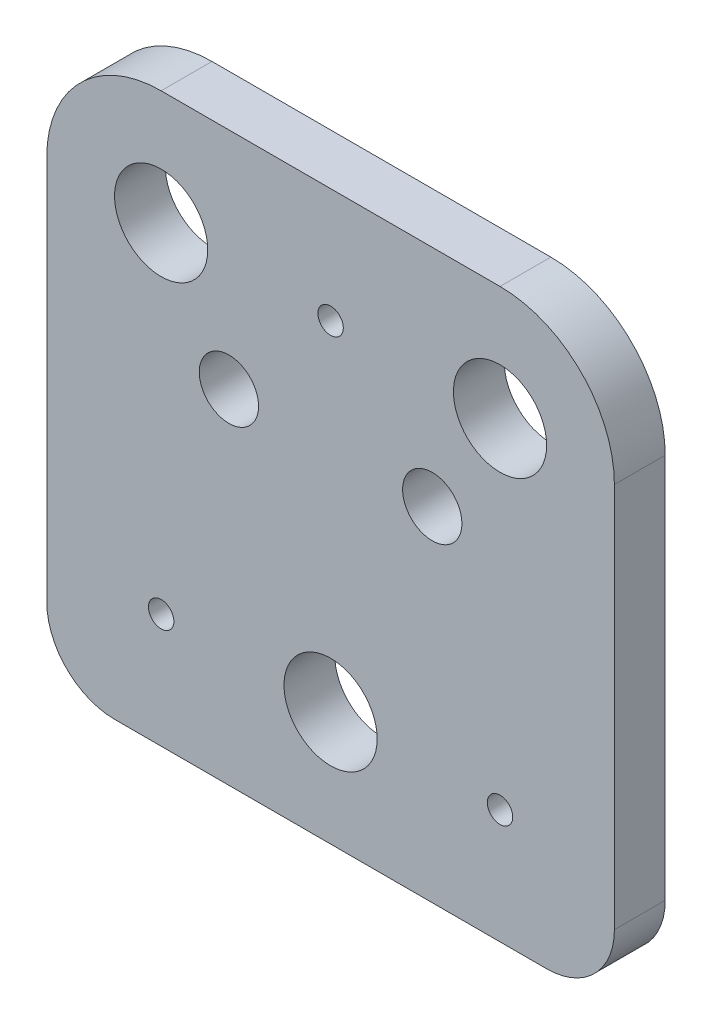
from build123d import *

# Parameters (mm, degrees)
ESBO_O1_R                = 5.5
RESSALTO_EXTRUS_O1_DEPTH = 6
ESBO_O2_W                = 13.5
ESBO_O2_H                = 13.5
RESSALTO_EXTRUS_O2_DEPTH = 6
FILETE1_R                = 8
ESBO_O3_R                = 1.5
CORTE_EXTRUS_O1_DEPTH    = 6
ESBO_O5_R                = 3.5
CORTE_EXTRUS_O2_DEPTH    = 6


with BuildPart() as part:
    # Esboço1 → Ressalto-extrusão1 (new body)
    with BuildSketch(Plane.XY):
        with BuildLine():
            Line((-20, 33.5), (20, 33.5))
            ThreePointArc((20, 33.5), (29.545941546, 29.545941546), (33.5, 20))
            Line((33.5, 20), (33.5, -20))
            ThreePointArc((33.5, -20), (29.545941546, -29.545941546), (20, -33.5))
            Line((20, -33.5), (-20, -33.5))
            ThreePointArc((-20, -33.5), (-29.545941546, -29.545941546), (-33.5, -20))
            Line((-33.5, -20), (-33.5, 20))
            ThreePointArc((-33.5, 20), (-29.545941546, 29.545941546), (-20, 33.5))
        make_face()
        with Locations((-20, 20)):
            Circle(ESBO_O1_R, mode=Mode.SUBTRACT)
        with Locations((20, 20)):
            Circle(ESBO_O1_R, mode=Mode.SUBTRACT)
        with Locations((0, -20)):
            Circle(ESBO_O1_R, mode=Mode.SUBTRACT)
    extrude(amount=RESSALTO_EXTRUS_O1_DEPTH)

    # Esboço2 → Ressalto-extrusão2 (add)
    with BuildSketch(Plane(origin=(0, 0, 0), x_dir=(-1, 0, 0), z_dir=(0, 0, -1))):
        with Locations((-26.75, -26.75)):
            Rectangle(ESBO_O2_W, ESBO_O2_H)
        with Locations((26.75, -26.75)):
            Rectangle(ESBO_O2_W, ESBO_O2_H)
    extrude(amount=-RESSALTO_EXTRUS_O2_DEPTH)

    # Filete1
    filete1_edges = [part.edges().sort_by_distance(p)[0] for p in [
        (33.5, -33.5, 3),
        (-33.5, -33.5, 3),
    ]]
    fillet(filete1_edges, radius=FILETE1_R)

    # Esboço3 → Corte-extrusão1 (cut)
    with BuildSketch(Plane(origin=(0, 0, 0), x_dir=(-1, 0, 0), z_dir=(0, 0, -1))):
        with Locations((0, 20)):
            Circle(ESBO_O3_R)
        with Locations((20, -20)):
            Circle(ESBO_O3_R)
        with Locations((-20, -20)):
            Circle(ESBO_O3_R)
    extrude(amount=-CORTE_EXTRUS_O1_DEPTH, mode=Mode.SUBTRACT)

    # Esboço5 → Corte-extrusão2 (cut)
    with BuildSketch(Plane.XY.offset(6)):
        with Locations((-12, 7)):
            Circle(ESBO_O5_R)
        with Locations((12, 7)):
            Circle(ESBO_O5_R)
    extrude(amount=-CORTE_EXTRUS_O2_DEPTH, mode=Mode.SUBTRACT)


solid = part.part
